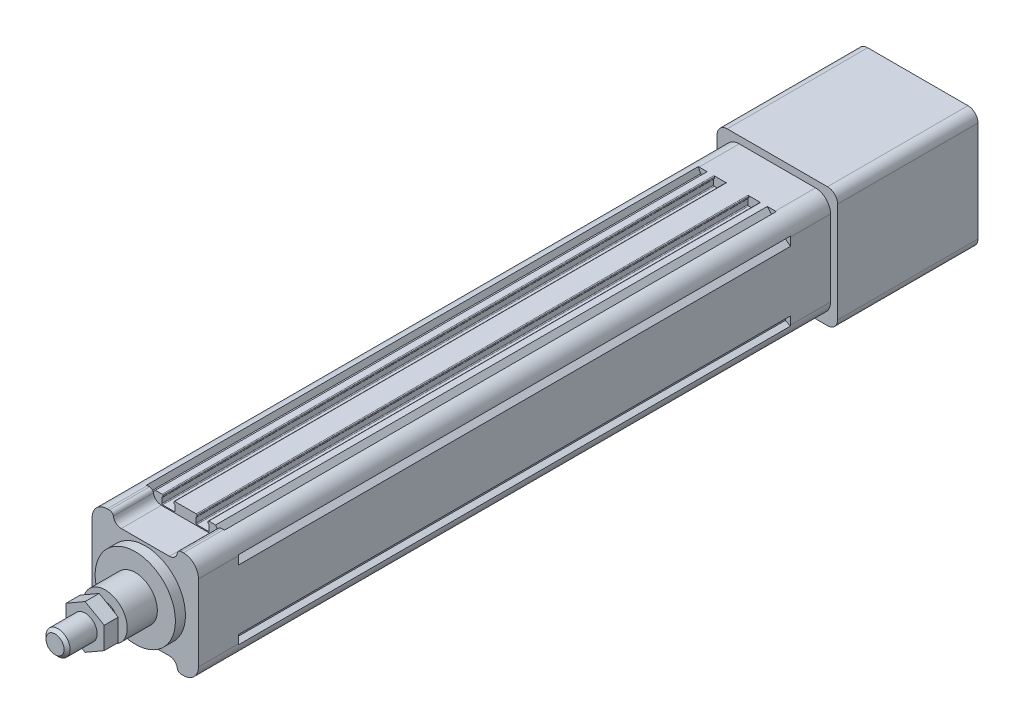
from build123d import *

# Parameters (mm, degrees)
SKETCH_1_R             = 2.1
EXTRUDE_1_DEPTH        = 275
EXTRUDE_2_DEPTH        = 20
SKETCH_7_R             = 20
EXTRUDE_3_DEPTH        = 5
SKETCH_9_R             = 11
EXTRUDE_4_DEPTH        = 15
SKETCH_10_R            = 6
EXTRUDE_5_DEPTH        = 25
EXTRUDE_START          = 20
EXTRUDE_6_DEPTH        = 20
EXTRUDE_7_DEPTH        = 70
SKETCH_14_R            = 19
CUT_EXTRUDE_2_DEPTH    = 70
HOLE_WIZARD_M6_1_D     = 5
HOLE_WIZARD_M6_1_DEPTH = 15
HOLE_WIZARD_M6_1_TIP   = 1.502151548
CHAMFER_1_SIZE         = 1.5
EXTRUDE_START_2        = 3
EXTRUDE_8_DEPTH        = 7


with BuildPart() as part:
    # 草图1 → 凸台-拉伸1 (new body)
    with BuildSketch(Plane.XY):
        with BuildLine():
            Line((-18.2, 24), (-19.443439638, 26.486879276))
            ThreePointArc((-19.443439638, 26.486879276), (-24.303300859, 24.303300859), (-26.486879276, 19.443439638))
            Line((-26.486879276, 19.443439638), (-24, 18.2))
            Line((-24, 18.2), (-24, 17.1))
            Line((-24, 17.1), (-26.5, 15))
            Line((-26.5, 15), (-26.5, -15))
            Line((-26.5, -15), (-24, -17.1))
            Line((-24, -17.1), (-24, -18.2))
            Line((-24, -18.2), (-26.486879276, -19.443439638))
            ThreePointArc((-26.486879276, -19.443439638), (-24.303300859, -24.303300859), (-19.443439638, -26.486879276))
            Line((-19.443439638, -26.486879276), (-18.2, -24))
            Line((-18.2, -24), (-17.1, -24))
            Line((-17.1, -24), (-15, -26.5))
            Line((-15, -26.5), (-11.65, -26.5))
            ThreePointArc((-11.65, -26.5), (-11.367157288, -26.382842712), (-11.25, -26.1))
            Line((-11.25, -26.1), (-11.25, -25.6))
            ThreePointArc((-11.25, -25.6), (-11.367157288, -25.317157288), (-11.65, -25.2))
            Line((-11.65, -25.2), (-11.75, -25.2))
            Line((-11.75, -25.2), (-11.75, -22.4))
            ThreePointArc((-11.75, -22.4), (-11.632842712, -22.117157288), (-11.35, -22))
            Line((-11.35, -22), (-5.65, -22))
            ThreePointArc((-5.65, -22), (-5.367157288, -22.117157288), (-5.25, -22.4))
            Line((-5.25, -22.4), (-5.25, -25.2))
            Line((-5.25, -25.2), (-5.35, -25.2))
            ThreePointArc((-5.35, -25.2), (-5.632842712, -25.317157288), (-5.75, -25.6))
            Line((-5.75, -25.6), (-5.75, -26.1))
            ThreePointArc((-5.75, -26.1), (-5.632842712, -26.382842712), (-5.35, -26.5))
            Line((-5.35, -26.5), (5.35, -26.5))
            ThreePointArc((5.35, -26.5), (5.632842712, -26.382842712), (5.75, -26.1))
            Line((5.75, -26.1), (5.75, -25.6))
            ThreePointArc((5.75, -25.6), (5.632842712, -25.317157288), (5.35, -25.2))
            Line((5.35, -25.2), (5.25, -25.2))
            Line((5.25, -25.2), (5.25, -22.4))
            ThreePointArc((5.25, -22.4), (5.367157288, -22.117157288), (5.65, -22))
            Line((5.65, -22), (11.35, -22))
            ThreePointArc((11.35, -22), (11.632842712, -22.117157288), (11.75, -22.4))
            Line((11.75, -22.4), (11.75, -25.2))
            Line((11.75, -25.2), (11.65, -25.2))
            ThreePointArc((11.65, -25.2), (11.367157288, -25.317157288), (11.25, -25.6))
            Line((11.25, -25.6), (11.25, -26.1))
            ThreePointArc((11.25, -26.1), (11.367157288, -26.382842712), (11.65, -26.5))
            Line((11.65, -26.5), (15, -26.5))
            Line((15, -26.5), (17.1, -24))
            Line((17.1, -24), (18.2, -24))
            Line((18.2, -24), (19.443439638, -26.486879276))
            ThreePointArc((19.443439638, -26.486879276), (24.303300859, -24.303300859), (26.486879276, -19.443439638))
            Line((26.486879276, -19.443439638), (24, -18.2))
            Line((24, -18.2), (24, -17.1))
            Line((24, -17.1), (26.5, -15))
            Line((26.5, -15), (26.5, 15))
            Line((26.5, 15), (24, 17.1))
            Line((24, 17.1), (24, 18.2))
            Line((24, 18.2), (26.486879276, 19.443439638))
            ThreePointArc((26.486879276, 19.443439638), (24.303300859, 24.303300859), (19.443439638, 26.486879276))
            Line((19.443439638, 26.486879276), (18.2, 24))
            Line((18.2, 24), (17.1, 24))
            Line((17.1, 24), (15, 26.5))
            Line((15, 26.5), (11.65, 26.5))
            ThreePointArc((11.65, 26.5), (11.367157288, 26.382842712), (11.25, 26.1))
            Line((11.25, 26.1), (11.25, 25.6))
            ThreePointArc((11.25, 25.6), (11.367157288, 25.317157288), (11.65, 25.2))
            Line((11.65, 25.2), (11.75, 25.2))
            Line((11.75, 25.2), (11.75, 22.4))
            ThreePointArc((11.75, 22.4), (11.632842712, 22.117157288), (11.35, 22))
            Line((11.35, 22), (5.65, 22))
            ThreePointArc((5.65, 22), (5.367157288, 22.117157288), (5.25, 22.4))
            Line((5.25, 22.4), (5.25, 25.2))
            Line((5.25, 25.2), (5.35, 25.2))
            ThreePointArc((5.35, 25.2), (5.632842712, 25.317157288), (5.75, 25.6))
            Line((5.75, 25.6), (5.75, 26.1))
            ThreePointArc((5.75, 26.1), (5.632842712, 26.382842712), (5.35, 26.5))
            Line((5.35, 26.5), (-5.35, 26.5))
            ThreePointArc((-5.35, 26.5), (-5.632842712, 26.382842712), (-5.75, 26.1))
            Line((-5.75, 26.1), (-5.75, 25.6))
            ThreePointArc((-5.75, 25.6), (-5.632842712, 25.317157288), (-5.35, 25.2))
            Line((-5.35, 25.2), (-5.25, 25.2))
            Line((-5.25, 25.2), (-5.25, 22.4))
            ThreePointArc((-5.25, 22.4), (-5.367157288, 22.117157288), (-5.65, 22))
            Line((-5.65, 22), (-11.35, 22))
            ThreePointArc((-11.35, 22), (-11.632842712, 22.117157288), (-11.75, 22.4))
            Line((-11.75, 22.4), (-11.75, 25.2))
            Line((-11.75, 25.2), (-11.65, 25.2))
            ThreePointArc((-11.65, 25.2), (-11.367157288, 25.317157288), (-11.25, 25.6))
            Line((-11.25, 25.6), (-11.25, 26.1))
            ThreePointArc((-11.25, 26.1), (-11.367157288, 26.382842712), (-11.65, 26.5))
            Line((-11.65, 26.5), (-15, 26.5))
            Line((-15, 26.5), (-17.1, 24))
            Line((-17.1, 24), (-18.2, 24))
        make_face()
        with Locations((19, 19)):
            Circle(SKETCH_1_R, mode=Mode.SUBTRACT)
        with Locations((19, -19)):
            Circle(SKETCH_1_R, mode=Mode.SUBTRACT)
        with Locations((-19, -19)):
            Circle(SKETCH_1_R, mode=Mode.SUBTRACT)
        with Locations((-19, 19)):
            Circle(SKETCH_1_R, mode=Mode.SUBTRACT)
        with BuildLine():
            Line((19.773719933, 3), (23.3, 3))
            Line((23.3, 3), (23.3, -3))
            Line((23.3, -3), (19.773719933, -3))
            ThreePointArc((19.773719933, -3), (0, -20), (-19.773719933, -3))
            Line((-19.773719933, -3), (-23.3, -3))
            Line((-23.3, -3), (-23.3, 3))
            Line((-23.3, 3), (-19.773719933, 3))
            ThreePointArc((-19.773719933, 3), (0, 20), (19.773719933, 3))
        make_face(mode=Mode.SUBTRACT)
    extrude(amount=EXTRUDE_1_DEPTH)

    # 草图6 → 凸台-拉伸2 (add)
    with BuildSketch(Plane.XY.offset(275)):
        with BuildLine():
            Line((-26.5, -19), (-26.5, 19))
            ThreePointArc((-26.5, 19), (-24.303300859, 24.303300859), (-19, 26.5))
            Line((-19, 26.5), (-17.916079783, 26.5))
            ThreePointArc((-17.916079783, 26.5), (-16.625085334, 26.027525232), (-15.944053189, 24.833333333))
            ThreePointArc((-15.944053189, 24.833333333), (-14.581988897, 22.444949537), (-12, 21.5))
            Line((-12, 21.5), (12, 21.5))
            ThreePointArc((12, 21.5), (14.581988897, 22.444949537), (15.944053189, 24.833333333))
            ThreePointArc((15.944053189, 24.833333333), (16.625085334, 26.027525232), (17.916079783, 26.5))
            Line((17.916079783, 26.5), (19, 26.5))
            ThreePointArc((19, 26.5), (24.303300859, 24.303300859), (26.5, 19))
            Line((26.5, 19), (26.5, -19))
            ThreePointArc((26.5, -19), (24.303300859, -24.303300859), (19, -26.5))
            Line((19, -26.5), (17.916079783, -26.5))
            ThreePointArc((17.916079783, -26.5), (16.625085334, -26.027525232), (15.944053189, -24.833333333))
            ThreePointArc((15.944053189, -24.833333333), (14.581988897, -22.444949537), (12, -21.5))
            Line((12, -21.5), (-12, -21.5))
            ThreePointArc((-12, -21.5), (-14.581988897, -22.444949537), (-15.944053189, -24.833333333))
            ThreePointArc((-15.944053189, -24.833333333), (-16.625085334, -26.027525232), (-17.916079783, -26.5))
            Line((-17.916079783, -26.5), (-19, -26.5))
            ThreePointArc((-19, -26.5), (-24.303300859, -24.303300859), (-26.5, -19))
        make_face()
    extrude(amount=EXTRUDE_2_DEPTH)

    # 草图7 → 凸台-拉伸3 (add)
    with BuildSketch(Plane.XY.offset(295)):
        Circle(SKETCH_7_R)
    extrude(amount=EXTRUDE_3_DEPTH)

    # 草图9 → 凸台-拉伸4 (add)
    with BuildSketch(Plane.XY.offset(300)):
        Circle(SKETCH_9_R)
    extrude(amount=EXTRUDE_4_DEPTH)

    # 草图10 → 凸台-拉伸5 (add)
    with BuildSketch(Plane.XY.offset(315)):
        Circle(SKETCH_10_R)
    extrude(amount=EXTRUDE_5_DEPTH)

    # 草图11 → 凸台-拉伸6 (add)
    with BuildSketch(Plane(origin=(0, 0, 0), x_dir=(-1, 0, 0), z_dir=(0, 0, -1)).offset(EXTRUDE_START)):
        with BuildLine():
            Line((-19, -26.5), (19, -26.5))
            ThreePointArc((19, -26.5), (24.303300859, -24.303300859), (26.5, -19))
            Line((26.5, -19), (26.5, 19))
            ThreePointArc((26.5, 19), (24.303300859, 24.303300859), (19, 26.5))
            Line((19, 26.5), (-19, 26.5))
            ThreePointArc((-19, 26.5), (-24.303300859, 24.303300859), (-26.5, 19))
            Line((-26.5, 19), (-26.5, -19))
            ThreePointArc((-26.5, -19), (-24.303300859, -24.303300859), (-19, -26.5))
        make_face()
    extrude(amount=-EXTRUDE_6_DEPTH)

    # 草图12 → 凸台-拉伸7 (add)
    with BuildSketch(Plane(origin=(0, 0, -20), x_dir=(-1, 0, 0), z_dir=(0, 0, -1))):
        with BuildLine():
            Line((-25, -30), (25, -30))
            ThreePointArc((25, -30), (28.535533906, -28.535533906), (30, -25))
            Line((30, -25), (30, 25))
            ThreePointArc((30, 25), (28.535533906, 28.535533906), (25, 30))
            Line((25, 30), (-25, 30))
            ThreePointArc((-25, 30), (-28.535533906, 28.535533906), (-30, 25))
            Line((-30, 25), (-30, -25))
            ThreePointArc((-30, -25), (-28.535533906, -28.535533906), (-25, -30))
        make_face()
    extrude(amount=EXTRUDE_7_DEPTH)

    # 草图14 → 切除-拉伸2 (cut)
    with BuildSketch(Plane(origin=(0, 0, -90), x_dir=(-1, 0, 0), z_dir=(0, 0, -1))):
        Circle(SKETCH_14_R)
    extrude(amount=-CUT_EXTRUDE_2_DEPTH, mode=Mode.SUBTRACT)

    # M6 螺纹孔1
    with Locations(Plane.ZY.offset(26.5)):
        with Locations((285, 11), (285, -11), (-10, 11), (-10, -11)):
            Hole(HOLE_WIZARD_M6_1_D / 2, depth=HOLE_WIZARD_M6_1_DEPTH)
            with Locations((0, 0, -(HOLE_WIZARD_M6_1_DEPTH + HOLE_WIZARD_M6_1_TIP / 2))):  # 118° drill point
                Cone(0, HOLE_WIZARD_M6_1_D / 2, HOLE_WIZARD_M6_1_TIP, mode=Mode.SUBTRACT)

    # 倒角1
    chamfer_1_edges = [part.edges().sort_by_distance(p)[0] for p in [
        (-6, 0, 340),
    ]]
    chamfer(chamfer_1_edges, length=CHAMFER_1_SIZE)

    # 草图17 → 凸台-拉伸8 (add)
    with BuildSketch(Plane.XY.offset(315).offset(EXTRUDE_START_2)):
        Polygon((0, 10.969655115), (-9.5, 5.484827557), (-9.5, -5.484827557), (0, -10.969655115), (9.5, -5.484827557), (9.5, 5.484827557), align=None)
    extrude(amount=EXTRUDE_8_DEPTH)


solid = part.part
